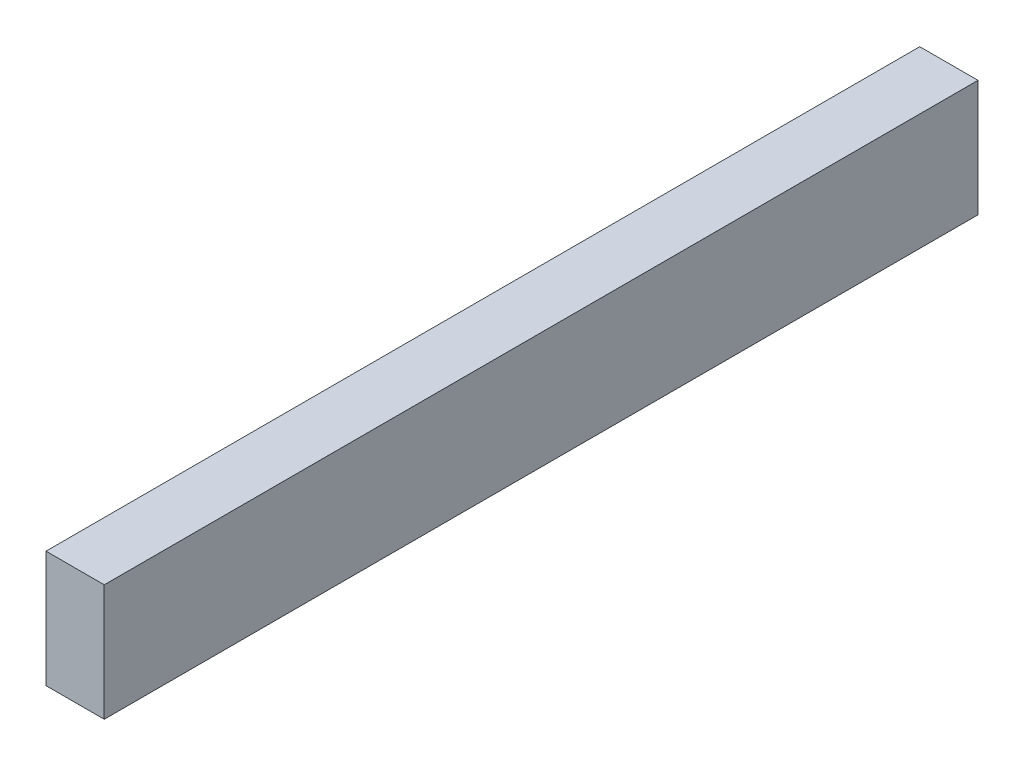
from build123d import *

# Parameters (mm, degrees)
SKETCH1_W           = 25.4
SKETCH1_H           = 50.8
BOSS_EXTRUDE1_DEPTH = 381


with BuildPart() as part:
    # Sketch1 → Boss-Extrude1 (new body)
    with BuildSketch(Plane.XY):
        with Locations((12.7, 25.4)):
            Rectangle(SKETCH1_W, SKETCH1_H)
    extrude(amount=BOSS_EXTRUDE1_DEPTH)


solid = part.part
